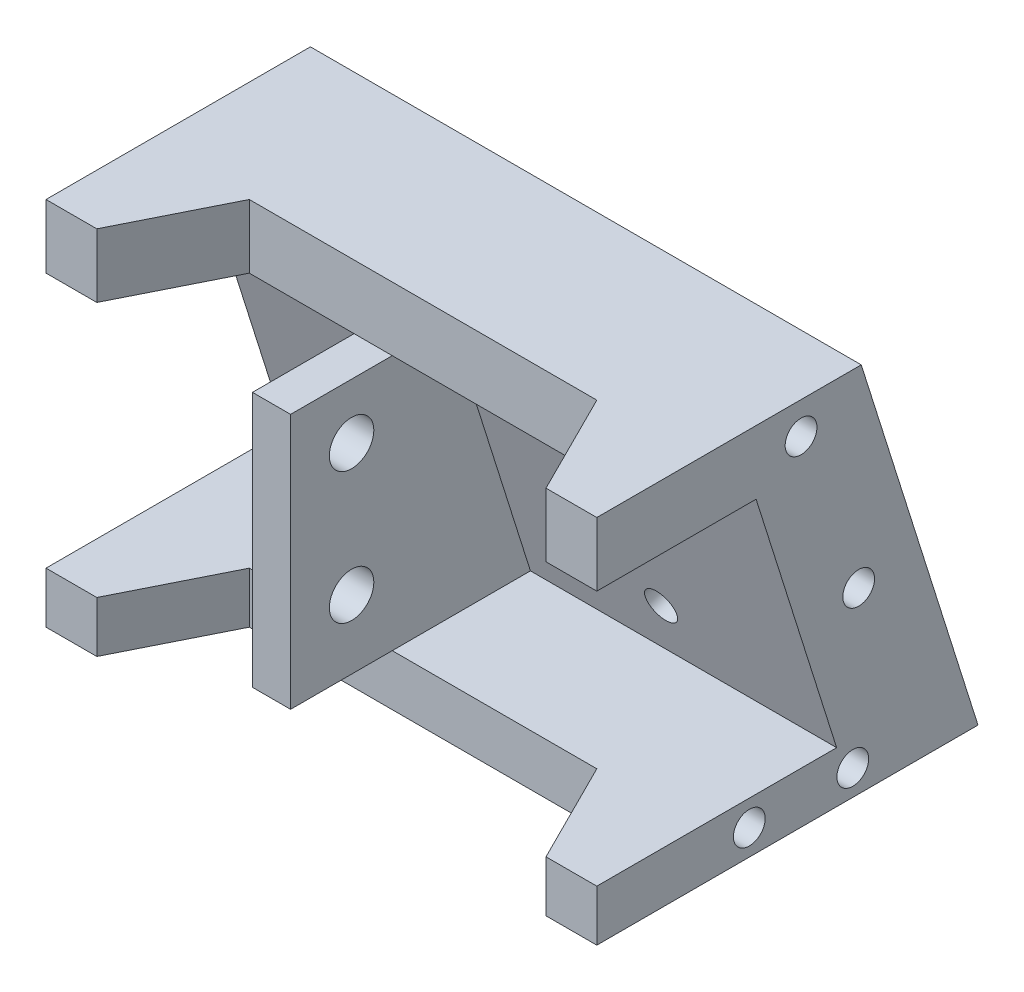
from build123d import *

# Parameters (mm, degrees)
SKETCH1_W                = 43.35
SKETCH1_H                = 29.15
BOSS_EXTRUDE1_DEPTH      = 30
CUT_EXTRUDE6_DEPTH       = 28.13
SKETCH11_W               = 18.87556933
SKETCH11_H               = 20.106349468
CUT_EXTRUDE8_DEPTH       = 50
SKETCH14_W               = 3
SKETCH14_H               = 29.15
BOSS_EXTRUDE5_DEPTH      = 30
SKETCH15_W               = 8
SKETCH15_H               = 4.023650532
CUT_EXTRUDE10_DEPTH      = 5
SKETCH16_W               = 8
SKETCH16_H               = 4
CUT_EXTRUDE11_DEPTH      = 5
CUT_EXTRUDE12_DEPTH      = 4
CUT_EXTRUDE12_DEPTH_BACK = 3
SKETCH17_R               = 1.75
CUT_EXTRUDE14_DEPTH      = 50
SKETCH30_R               = 1.25
CUT_EXTRUDE23_DEPTH      = 45
SKETCH31_R               = 1.25
CUT_EXTRUDE24_DEPTH      = 50
SKETCH32_R               = 1.25
CUT_EXTRUDE25_DEPTH      = 50
CUT_EXTRUDE29_DEPTH      = 5
BOSS_EXTRUDE13_DEPTH     = 16.25
BOSS_EXTRUDE14_DEPTH     = 24.1
SKETCH74_R               = 1.25
CUT_EXTRUDE30_DEPTH      = 10


with BuildPart() as part:
    # Sketch1 → Boss-Extrude1 (new body)
    with BuildSketch(Plane.XY):
        with Locations((-32.56399028, -14.719171637)):
            Rectangle(SKETCH1_W, SKETCH1_H)
    extrude(amount=-BOSS_EXTRUDE1_DEPTH)

    # Sketch9 → Cut-Extrude6 (cut)
    with BuildSketch(Plane.XZ.offset(29.294171637)):
        Polygon((-14.88899028, 0), (-18.88899028, -8), (-46.23899028, -8), (-50.23899028, 0), align=None)
    extrude(amount=-CUT_EXTRUDE6_DEPTH, mode=Mode.SUBTRACT)

    # Sketch11 → Cut-Extrude8 (cut)
    with BuildSketch(Plane.ZY.offset(54.23899028)):
        with Locations((-9.437784665, -15.217346371)):
            Rectangle(SKETCH11_W, SKETCH11_H)
    extrude(amount=-CUT_EXTRUDE8_DEPTH, mode=Mode.SUBTRACT)

    # Sketch14 → Boss-Extrude5 (add)
    with BuildSketch(Plane(origin=(0, 0, -30), x_dir=(-1, 0, 0), z_dir=(0, 0, -1))):
        with Locations((28.63899028, -14.719171637)):
            Rectangle(SKETCH14_W, SKETCH14_H)
    extrude(amount=-BOSS_EXTRUDE5_DEPTH)

    # Sketch15 → Cut-Extrude10 (cut)
    with BuildSketch(Plane.ZY.offset(30.13899028)):
        with Locations((-4, -27.282346371)):
            Rectangle(SKETCH15_W, SKETCH15_H)
    extrude(amount=-CUT_EXTRUDE10_DEPTH, mode=Mode.SUBTRACT)

    # Sketch16 → Cut-Extrude11 (cut)
    with BuildSketch(Plane.ZY.offset(30.13899028)):
        with Locations((-4, -3.164171637)):
            Rectangle(SKETCH16_W, SKETCH16_H)
    extrude(amount=-CUT_EXTRUDE11_DEPTH, mode=Mode.SUBTRACT)

    # Sketch17 → Cut-Extrude12 (cut, two sides: drawn at the far end of the back side and taken through both)
    with BuildSketch(Plane.ZY.offset(27.13899028).offset(-CUT_EXTRUDE12_DEPTH_BACK)):
        with Locations(Location((-4.799999987, -19.869171637, 0), (0, 0, 180))):
            Circle(SKETCH17_R)
        with Locations(Location((-4.799999987, -9.519171637, 0), (0, 0, 180))):
            Circle(SKETCH17_R)
    extrude(amount=CUT_EXTRUDE12_DEPTH + CUT_EXTRUDE12_DEPTH_BACK, mode=Mode.SUBTRACT)

    # Sketch20 → Cut-Extrude14 (cut)
    with BuildSketch(Plane.ZY.offset(54.23899028)):
        Polygon((-30, -29.294171637), (-30, -0.144171637), (-20.81, -0.144171637), align=None)
    extrude(amount=-CUT_EXTRUDE14_DEPTH, mode=Mode.SUBTRACT)

    # Sketch30 → Cut-Extrude23 (cut)
    with BuildSketch(Plane.ZY.offset(54.23899028)):
        with Locations(Location((-12.001192799, -27.284171637, 0), (0, 0, 270))):
            Circle(SKETCH30_R)
        with Locations(Location((-20.145814089, -27.284171637, 0), (0, 0, 270))):
            Circle(SKETCH30_R)
    extrude(amount=-CUT_EXTRUDE23_DEPTH, mode=Mode.SUBTRACT)

    # Sketch31 → Cut-Extrude24 (cut)
    with BuildSketch(Plane.ZY.offset(54.23899028)):
        with Locations(Location((-16.073503444, -2.654171637, 0), (0, 0, 270))):
            Circle(SKETCH31_R)
    extrude(amount=-CUT_EXTRUDE24_DEPTH, mode=Mode.SUBTRACT)

    # Sketch32 → Cut-Extrude25 (cut)
    with BuildSketch(Plane.ZY.offset(54.23899028)):
        with Locations(Location((-20.609812978, -15.243146641, 0), (0, 0, 270))):
            Circle(SKETCH32_R)
    extrude(amount=-CUT_EXTRUDE25_DEPTH, mode=Mode.SUBTRACT)

    # Sketch56 → Cut-Extrude29 (cut)
    with BuildSketch(Plane.XZ.offset(1.164171637)):
        Polygon((-14.88899028, 0), (-18.88899028, -8), (-46.23899028, -8), (-50.23899028, 0), align=None)
    extrude(amount=-CUT_EXTRUDE29_DEPTH, mode=Mode.SUBTRACT)

    # Sketch68 → Boss-Extrude13 (add)
    with BuildSketch(Plane(origin=(-27.13899028, 0, 0), x_dir=(0, 0, -1), z_dir=(1, 0, 0))):
        Polygon((18.87556933, -5.164171637), (12.53556933, -5.164171637), (18.87556933, -25.270521105), align=None)
    extrude(amount=BOSS_EXTRUDE13_DEPTH)

    # Sketch73 → Boss-Extrude14 (add)
    with BuildSketch(Plane.ZY.offset(30.13899028)):
        Polygon((-18.87556933, -5.164171637), (-12.53556933, -5.164171637), (-18.87556933, -25.270521105), align=None)
    extrude(amount=BOSS_EXTRUDE14_DEPTH)


with BuildPart() as body_2:
    # Mirror1: mirrored copy
    add(part.part.mirror(Plane(origin=(-10.88899028, -0.144171637, -30), x_dir=(0, 0, 1), z_dir=(1, 0, 0))))

    # Sketch74 → Cut-Extrude30 (cut)
    with BuildSketch(Plane(origin=(0, 5.954518238, -18.887291254), x_dir=(-1, 0, 0), z_dir=(0, 0.3006772394057975, -0.953725955242547))):
        with Locations(Location((-1.534437352, -25.546556259, 0), (0, 0, 90))):
            Circle(SKETCH74_R)
        with Locations(Location((-19.915437352, -25.546556259, 0), (0, 0, 90))):
            Circle(SKETCH74_R)
        with Locations(Location((-19.915437352, -14.283047692, 0), (0, 0, 90))):
            Circle(SKETCH74_R)
        with Locations(Location((-1.534437352, -14.283047692, 0), (0, 0, 90))):
            Circle(SKETCH74_R)
    extrude(amount=-CUT_EXTRUDE30_DEPTH, mode=Mode.SUBTRACT)


solid = body_2.part
